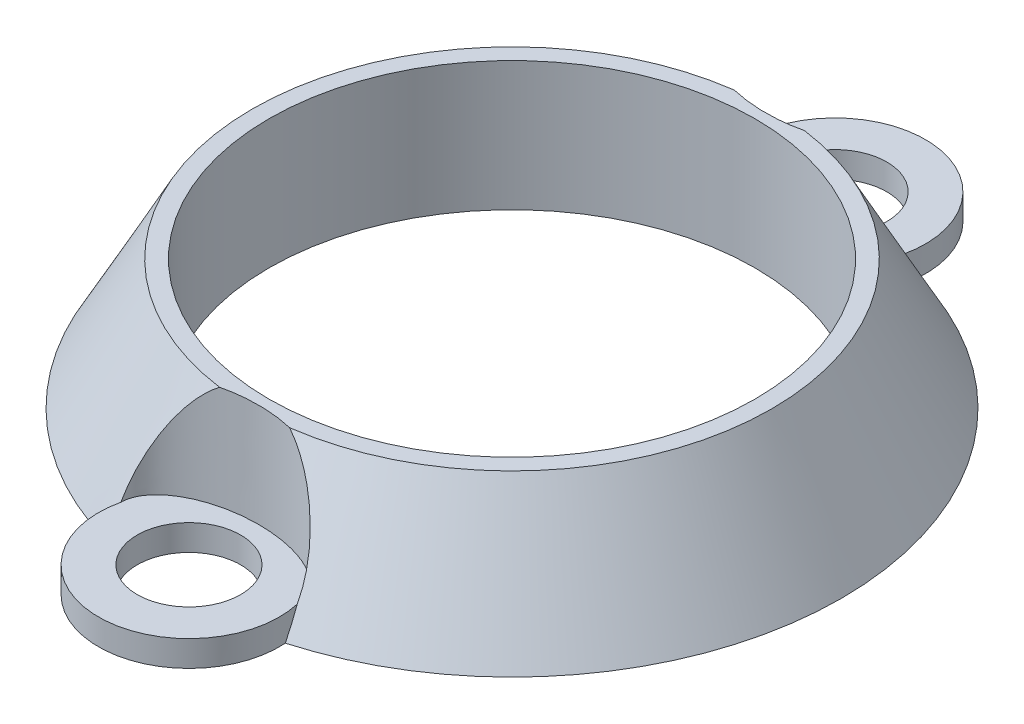
from build123d import *

# Parameters (mm, degrees)
BOSS_EXTRU_1_DEPTH      = 5
ESQUISSE12_R            = 3.5
BOSS_EXTRU_2_DEPTH      = 1
ESQUISSE10_RX           = 3.412746185
ESQUISSE10_RY           = 1.923364
ENL_V_MAT_EXTRU_5_DEPTH = 4
ESQUISSE13_R            = 2
ENL_V_MAT_EXTRU_7_DEPTH = 21.846162874
ESQUISSE11_R            = 9.4
ENL_V_MAT_EXTRU_6_DEPTH = 22.060923692


with BuildPart() as part:
    # Esquisse1 → Boss.-Extru.1 (new body)
    with BuildSketch(Plane(origin=(0, 0, 0), x_dir=(1, 0, 0), z_dir=(0, 1, 0))):
        with BuildLine():
            ThreePointArc((-4.625, -8.010734985), (0, -9.25), (4.625, -8.010734985))
            ThreePointArc((4.625, -8.010734985), (9.25, 0), (4.625, 8.010734985))
            ThreePointArc((4.625, 8.010734985), (0, 9.25), (-4.625, 8.010734985))
            ThreePointArc((-4.625, 8.010734985), (-9.25, 0), (-4.625, -8.010734985))
        make_face()
    extrude(amount=BOSS_EXTRU_1_DEPTH)

    # Esquisse8 → Révolution1 (revolve)
    with BuildSketch(Plane.XY, mode=Mode.PRIVATE) as r_volution1_sk:
        Polygon((12.75, 0), (9.25, 0), (9.25, 5), (10.05, 5), align=None)
    revolve(r_volution1_sk.sketch.rotate(Axis((0, 6.978175321, 0), (0, -1, 0)), 90), axis=Axis((0, 6.978175321, 0), (0, -1, 0)))

    # Esquisse12 → Boss.-Extru.2 (add)
    with BuildSketch(Plane.XZ):
        with Locations((0, 12.5)):
            Circle(ESQUISSE12_R)
        with Locations((0, -12.5)):
            Circle(ESQUISSE12_R)
    extrude(amount=-BOSS_EXTRU_2_DEPTH)

    # Esquisse10 → Enlèv. mat.-Extru.5 (cut)
    with BuildSketch(Plane(origin=(0, 5, 0), x_dir=(1, 0, 0), z_dir=(0, 1, 0))):
        with Locations((0, 11.723364)):
            Ellipse(ESQUISSE10_RX, ESQUISSE10_RY)
        with Locations((0, -11.723364)):
            Ellipse(ESQUISSE10_RX, ESQUISSE10_RY)
    extrude(amount=-ENL_V_MAT_EXTRU_5_DEPTH, mode=Mode.SUBTRACT)

    # Esquisse13 → Enlèv. mat.-Extru.7 (cut, through all)
    with BuildSketch(Plane(origin=(0, 1, 0), x_dir=(1, 0, 0), z_dir=(0, 1, 0))):
        with Locations(Location((0, 12.5, 0), (0, 0, 270))):
            Circle(ESQUISSE13_R)
        with Locations(Location((0, -12.5, 0), (0, 0, 270))):
            Circle(ESQUISSE13_R)
    extrude(amount=-ENL_V_MAT_EXTRU_7_DEPTH, mode=Mode.SUBTRACT)

    # Esquisse11 → Enlèv. mat.-Extru.6 (cut, through all)
    with BuildSketch(Plane(origin=(0, 5, 0), x_dir=(1, 0, 0), z_dir=(0, 1, 0))):
        with Locations(Location((0, 0, 0), (0, 0, 270))):
            Circle(ESQUISSE11_R)
    extrude(amount=-ENL_V_MAT_EXTRU_6_DEPTH, mode=Mode.SUBTRACT)


solid = part.part
